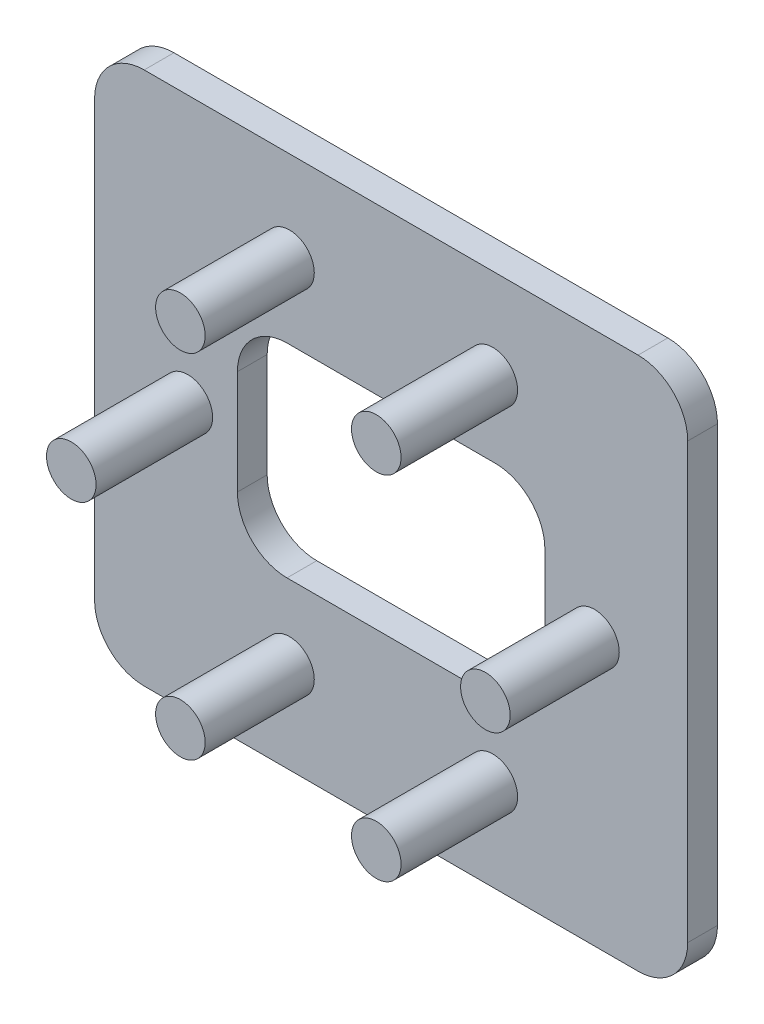
from build123d import *

# Parameters (mm, degrees)
SKETCH_1_R          = 2.5
EXTRUDE_1_DEPTH     = 3
SKETCH_1_4_R        = 2.5
EXTRUDE_2_DEPTH     = 14
EXTRUDE_2_2_DEPTH   = 14
EXTRUDE_2_3_DEPTH   = 14
EXTRUDE_2_4_DEPTH   = 14
EXTRUDE_2_5_DEPTH   = 14
EXTRUDE_2_6_DEPTH   = 14
SKETCH_2_R          = 2.5
EXTRUDE_3_DEPTH     = 7.75
CUT_EXTRUDE_1_DEPTH = 47.467004422


with BuildPart() as part:
    # 草圖1 → 填料-伸長1 (new body)
    with BuildSketch(Plane.XY):
        with BuildLine():
            Line((-29.9, 26.9), (29.9, 26.9))
            ThreePointArc((29.9, 26.9), (33.435533906, 25.435533906), (34.9, 21.9))
            Line((34.9, 21.9), (34.9, -21.9))
            ThreePointArc((34.9, -21.9), (33.435533906, -25.435533906), (29.9, -26.9))
            Line((29.9, -26.9), (-29.9, -26.9))
            ThreePointArc((-29.9, -26.9), (-33.435533906, -25.435533906), (-34.9, -21.9))
            Line((-34.9, -21.9), (-34.9, 21.9))
            ThreePointArc((-34.9, 21.9), (-33.435533906, 25.435533906), (-29.9, 26.9))
        make_face()
        with Locations((10.25, 17.753520778)):
            Circle(SKETCH_1_R, mode=Mode.SUBTRACT)
        with Locations((-10.25, -17.753520778)):
            Circle(SKETCH_1_R, mode=Mode.SUBTRACT)
        with Locations((-10.25, 17.753520778)):
            Circle(SKETCH_1_R, mode=Mode.SUBTRACT)
        with BuildLine():
            Line((-10.5, 10.253520778), (10.5, 10.253520778))
            ThreePointArc((10.5, 10.253520778), (14.035533906, 8.789054684), (15.5, 5.253520778))
            Line((15.5, 5.253520778), (15.5, -5.253520778))
            ThreePointArc((15.5, -5.253520778), (14.035533906, -8.789054684), (10.5, -10.253520778))
            Line((10.5, -10.253520778), (-10.5, -10.253520778))
            ThreePointArc((-10.5, -10.253520778), (-14.035533906, -8.789054684), (-15.5, -5.253520778))
            Line((-15.5, -5.253520778), (-15.5, 5.253520778))
            ThreePointArc((-15.5, 5.253520778), (-14.035533906, 8.789054684), (-10.5, 10.253520778))
        make_face(mode=Mode.SUBTRACT)
    extrude(amount=EXTRUDE_1_DEPTH)

    # 草圖3 → 除料-伸長1 (cut, through all)
    with BuildSketch(Plane(origin=(0, 0, 0), x_dir=(-1, 0, 0), z_dir=(0, 0, -1))):
        with BuildLine():
            Line((-29.9, -21.9), (-29.9, 21.9))
            ThreePointArc((-29.9, 21.9), (-28.435533906, 25.435533906), (-24.9, 26.9))
            Line((-24.9, 26.9), (-29.9, 26.9))
            ThreePointArc((-29.9, 26.9), (-33.435533906, 25.435533906), (-34.9, 21.9))
            Line((-34.9, 21.9), (-34.9, -21.9))
            ThreePointArc((-34.9, -21.9), (-33.435533906, -25.435533906), (-29.9, -26.9))
            Line((-29.9, -26.9), (-24.9, -26.9))
            ThreePointArc((-24.9, -26.9), (-28.435533906, -25.435533906), (-29.9, -21.9))
        make_face()
        with BuildLine():
            Line((29.9, 26.9), (24.9, 26.9))
            ThreePointArc((24.9, 26.9), (28.435533906, 25.435533906), (29.9, 21.9))
            Line((29.9, 21.9), (29.9, -21.9))
            ThreePointArc((29.9, -21.9), (28.435533906, -25.435533906), (24.9, -26.9))
            Line((24.9, -26.9), (29.9, -26.9))
            ThreePointArc((29.9, -26.9), (33.435533906, -25.435533906), (34.9, -21.9))
            Line((34.9, -21.9), (34.9, 21.9))
            ThreePointArc((34.9, 21.9), (33.435533906, 25.435533906), (29.9, 26.9))
        make_face()
    extrude(amount=-CUT_EXTRUDE_1_DEPTH, mode=Mode.SUBTRACT)


with BuildPart() as body_2:
    # 草圖1<4> → 填料-伸長2 (new body)
    with BuildSketch(Plane.XY):
        with Locations((20.5, 0)):
            Circle(SKETCH_1_4_R)
    extrude(amount=EXTRUDE_2_DEPTH)


with BuildPart() as body_3:
    # 草圖1<4> → Extrude 2 2 (new body)
    with BuildSketch(Plane.XY):
        with Locations((-20.5, 0)):
            Circle(SKETCH_1_4_R)
    extrude(amount=EXTRUDE_2_2_DEPTH)



with BuildPart() as body_4:
    # 草圖1<4> → Extrude 2 3 (new body)
    with BuildSketch(Plane.XY):
        with Locations((10.25, 17.753520778)):
            Circle(SKETCH_1_4_R)
    extrude(amount=EXTRUDE_2_3_DEPTH)


with BuildPart() as body_5:
    # 草圖1<4> → Extrude 2 4 (new body)
    with BuildSketch(Plane.XY):
        with Locations((10.25, -17.753520778)):
            Circle(SKETCH_1_4_R)
    extrude(amount=EXTRUDE_2_4_DEPTH)


with BuildPart() as body_6:
    # 草圖1<4> → Extrude 2 5 (new body)
    with BuildSketch(Plane.XY):
        with Locations((-10.25, -17.753520778)):
            Circle(SKETCH_1_4_R)
    extrude(amount=EXTRUDE_2_5_DEPTH)


with BuildPart() as body_7:
    # 草圖1<4> → Extrude 2 6 (new body)
    with BuildSketch(Plane.XY):
        with Locations((-10.25, 17.753520778)):
            Circle(SKETCH_1_4_R)
    extrude(amount=EXTRUDE_2_6_DEPTH)


with BuildPart() as body_3_1:
    add(body_3.part)

    add(body_4.part)  # 填料-伸長3 merges body 4

    add(body_5.part)  # 填料-伸長3 merges body 5
    # 草圖2 → 填料-伸長3 (add)
    with BuildSketch(Plane.XY.offset(7)):
        with Locations((-20.5, 0)):
            Circle(SKETCH_2_R)
        with Locations((10.25, 17.753520778)):
            Circle(SKETCH_2_R)
        with Locations((10.25, -17.753520778)):
            Circle(SKETCH_2_R)
    extrude(amount=EXTRUDE_3_DEPTH)


solid = Compound([part.part, body_2.part, body_6.part, body_7.part, body_3_1.part])
